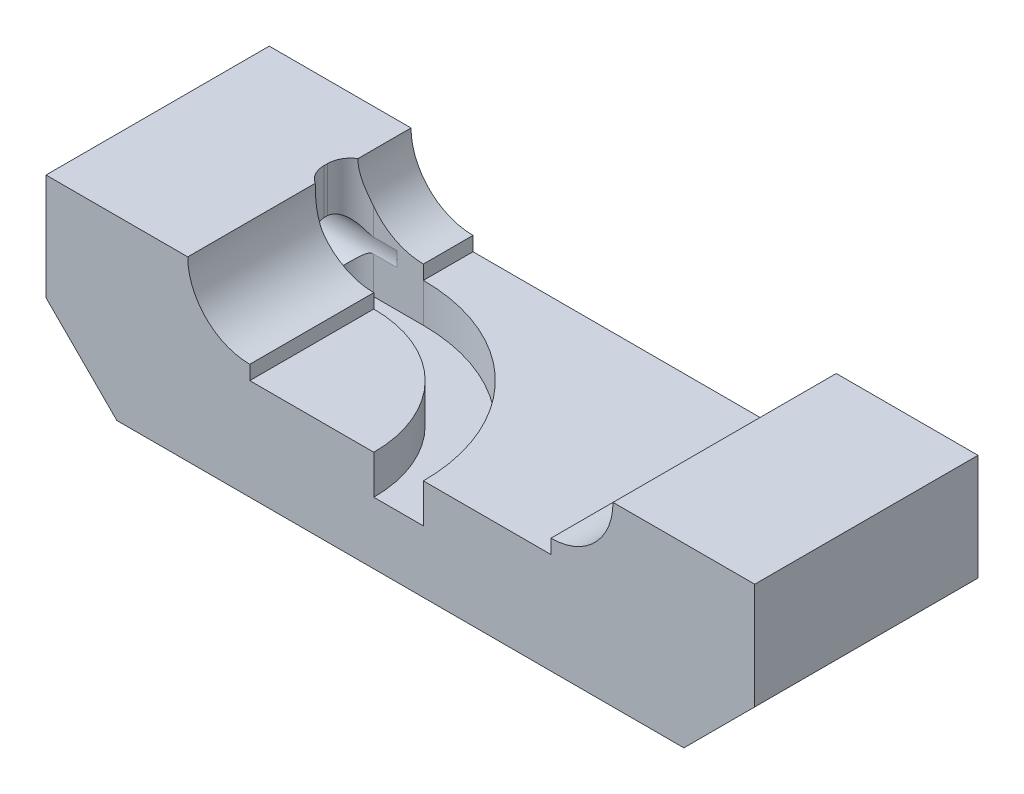
from build123d import *

# Parameters (mm, degrees)
SKETCH1_W               = 25.4
SKETCH1_H               = 8.001
BOSS_EXTRUDE1_DEPTH     = 6.35
CUT_EXTRUDE1_DEPTH      = 25.4
CUT_EXTRUDE2_DEPTH      = 14.940238753
CUT_EXTRUDE2_DEPTH_BACK = 1.905
CUT_EXTRUDE3_START      = -25.4
SKETCH5_R               = 0.9271
CUT_EXTRUDE3_DEPTH      = 6.35
SKETCH6_W               = 10.795
SKETCH6_H               = 8.001
CUT_EXTRUDE4_DEPTH      = 0.508
CHAMFER1_SIZE           = 2.54


with BuildPart() as part:
    # Sketch1 → Boss-Extrude1 (new body)
    with BuildSketch(Plane(origin=(0, 0, 0), x_dir=(1, 0, 0), z_dir=(0, 1, 0))):
        Rectangle(SKETCH1_W, SKETCH1_H)
    extrude(amount=BOSS_EXTRUDE1_DEPTH)

    # Sketch2 → Cut-Extrude1 (cut)
    with BuildSketch(Plane(origin=(0, 0, -4.0005), x_dir=(-1, 0, 0), z_dir=(0, 0, -1))):
        with BuildLine():
            Line((5.3975, 4.1275), (-5.3975, 4.1275))
            ThreePointArc((-5.3975, 4.1275), (-7.62, 6.35), (-5.3975, 8.5725))
            Line((-5.3975, 8.5725), (5.3975, 8.5725))
            ThreePointArc((5.3975, 8.5725), (7.62, 6.35), (5.3975, 4.1275))
        make_face()
    extrude(amount=-CUT_EXTRUDE1_DEPTH, mode=Mode.SUBTRACT)

    # Sketch4 → Cut-Extrude2 (cut, two sides: drawn at the far end of the back side and taken through both)
    with BuildSketch(Plane(origin=(0, 4.1275, 0), x_dir=(1, 0, 0), z_dir=(0, 1, 0)).offset(-CUT_EXTRUDE2_DEPTH_BACK)):
        with BuildLine():
            Line((0.8255, -4.0005), (-0.9525, -4.0005))
            ThreePointArc((-0.9525, -4.0005), (-2.254410358, -0.857410358), (-5.3975, 0.4445))
            Line((-5.3975, 0.4445), (-7.185501788, 0.4445))
            ThreePointArc((-7.185501788, 0.4445), (-7.769218436, 0.686283352), (-8.011001788, 1.27))
            Line((-8.011001788, 1.27), (-8.011001788, 1.397))
            ThreePointArc((-8.011001788, 1.397), (-7.769218436, 1.980716648), (-7.185501788, 2.2225))
            Line((-7.185501788, 2.2225), (-5.3975, 2.2225))
            ThreePointArc((-5.3975, 2.2225), (-0.997174501, 0.399825499), (0.8255, -4.0005))
        make_face()
    extrude(amount=CUT_EXTRUDE2_DEPTH + CUT_EXTRUDE2_DEPTH_BACK, mode=Mode.SUBTRACT)

    # Sketch5 → Cut-Extrude3 (cut)
    with BuildSketch(Plane(origin=(12.7, 0, 0), x_dir=(0, 0, -1), z_dir=(1, 0, 0)).offset(CUT_EXTRUDE3_START)):
        with Locations(Location((1.3335, 3.81, 0), (0, 0, 180))):
            Circle(SKETCH5_R)
    extrude(amount=CUT_EXTRUDE3_DEPTH, mode=Mode.SUBTRACT)

    # Sketch6 → Cut-Extrude4 (cut)
    with BuildSketch(Plane(origin=(0, 4.1275, 0), x_dir=(1, 0, 0), z_dir=(0, 1, 0))):
        Rectangle(SKETCH6_W, SKETCH6_H)
    extrude(amount=-CUT_EXTRUDE4_DEPTH, mode=Mode.SUBTRACT)

    # Chamfer1
    chamfer1_edges = [part.edges().sort_by_distance(p)[0] for p in [
        (-12.7, 0, 0),
        (12.7, 0, 0),
    ]]
    chamfer(chamfer1_edges, length=CHAMFER1_SIZE)


solid = part.part
